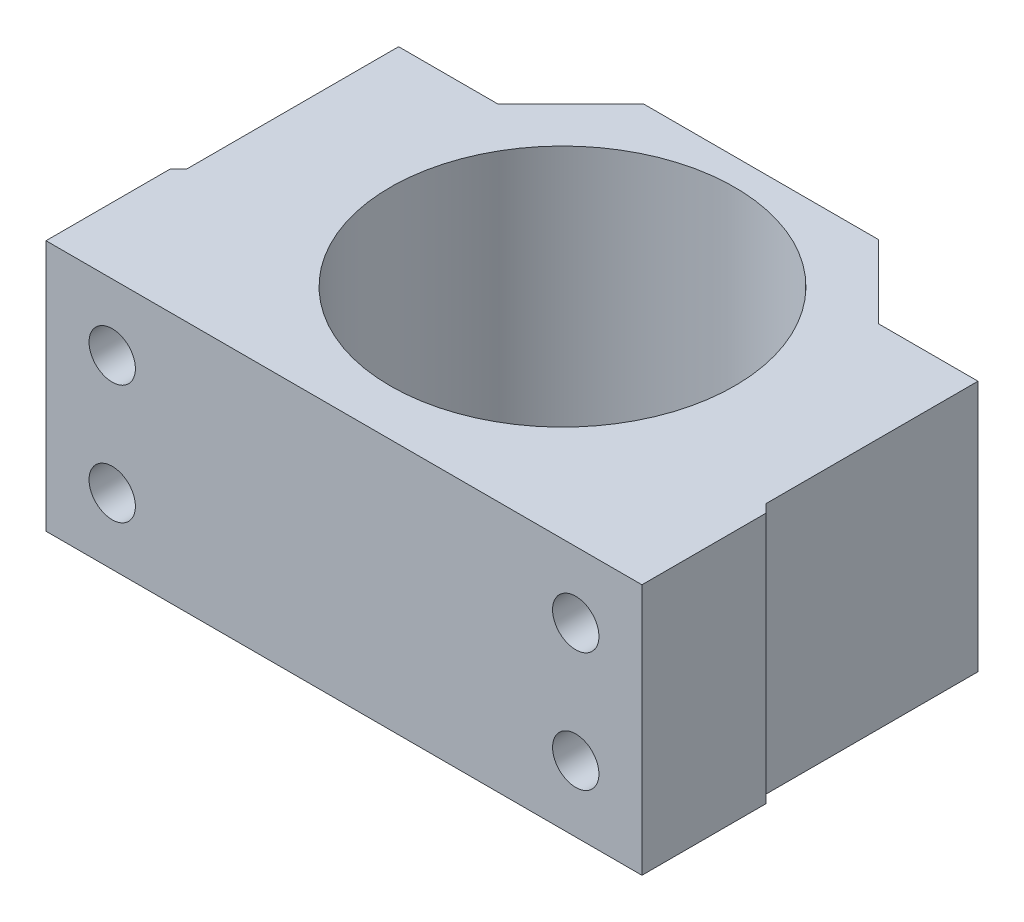
from build123d import *

# Parameters (mm, degrees)
SKETCH1_R           = 26
BOSS_EXTRUDE1_DEPTH = 38
SKETCH2_R           = 3.5
CUT_EXTRUDE1_DEPTH  = 117.250849889


with BuildPart() as part:
    # Sketch1 → Boss-Extrude1 (new body)
    with BuildSketch(Plane(origin=(0, 0, 0), x_dir=(1, 0, 0), z_dir=(0, 1, 0))):
        Polygon((88.75, 0), (90, 0), (90, 18.75), (88.75, 20), (88.75, 52), (73.75, 52), (62.74, 63.01), (27.26, 63.01), (16.25, 52), (1.25, 52), (1.25, 20), (0, 18.75), (0, 0), (1.25, 0), (45, 0), align=None)
        with Locations(Location((45, 33, 0), (0, 0, 270))):
            Circle(SKETCH1_R, mode=Mode.SUBTRACT)
    extrude(amount=BOSS_EXTRUDE1_DEPTH)

    # Sketch2 → Cut-Extrude1 (cut, through all)
    with BuildSketch(Plane.XY):
        with Locations((10, 28)):
            Circle(SKETCH2_R)
        with Locations((10, 10)):
            Circle(SKETCH2_R)
        with Locations((80, 28)):
            Circle(SKETCH2_R)
        with Locations((80, 10)):
            Circle(SKETCH2_R)
    extrude(amount=-CUT_EXTRUDE1_DEPTH, mode=Mode.SUBTRACT)


solid = part.part
